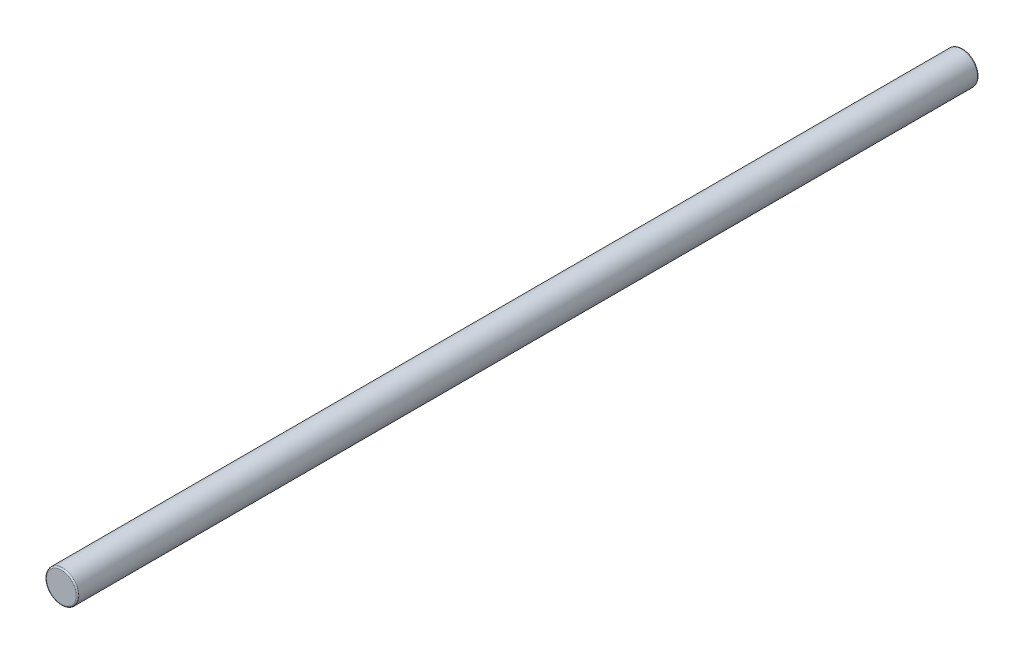
from build123d import *

# Parameters (mm, degrees)
CROQUIS1_R              = 6
SALIENTE_EXTRUIR1_DEPTH = 335
REDONDEO1_R             = 0.5


with BuildPart() as part:
    # Croquis1 → Saliente-Extruir1 (new body)
    with BuildSketch(Plane.XY):
        Circle(CROQUIS1_R)
    extrude(amount=SALIENTE_EXTRUIR1_DEPTH)

    # Redondeo1
    redondeo1_edges = [part.edges().sort_by_distance(p)[0] for p in [
        (-6, 0, 0),
        (-6, 0, 335),
    ]]
    fillet(redondeo1_edges, radius=REDONDEO1_R)


solid = part.part
